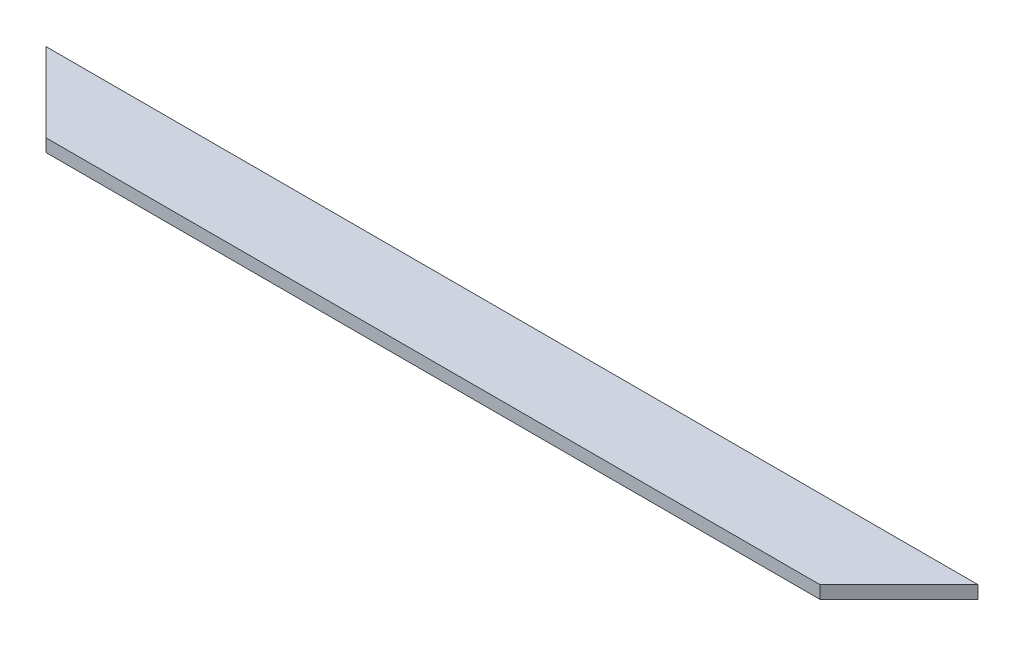
from build123d import *

# Parameters (mm, degrees)
BOSS_EXTRUDE1_DEPTH = 21.59


with BuildPart() as part:
    # Sketch1 → Boss-Extrude1 (new body)
    with BuildSketch(Plane(origin=(0, 0, 0), x_dir=(1, 0, 0), z_dir=(0, 1, 0))):
        Polygon((-756.804260698, 301.31372549), (816.408239302, 301.31372549), (683.058239302, 167.96372549), (-623.454260698, 167.96372549), align=None)
    extrude(amount=BOSS_EXTRUDE1_DEPTH)


solid = part.part
